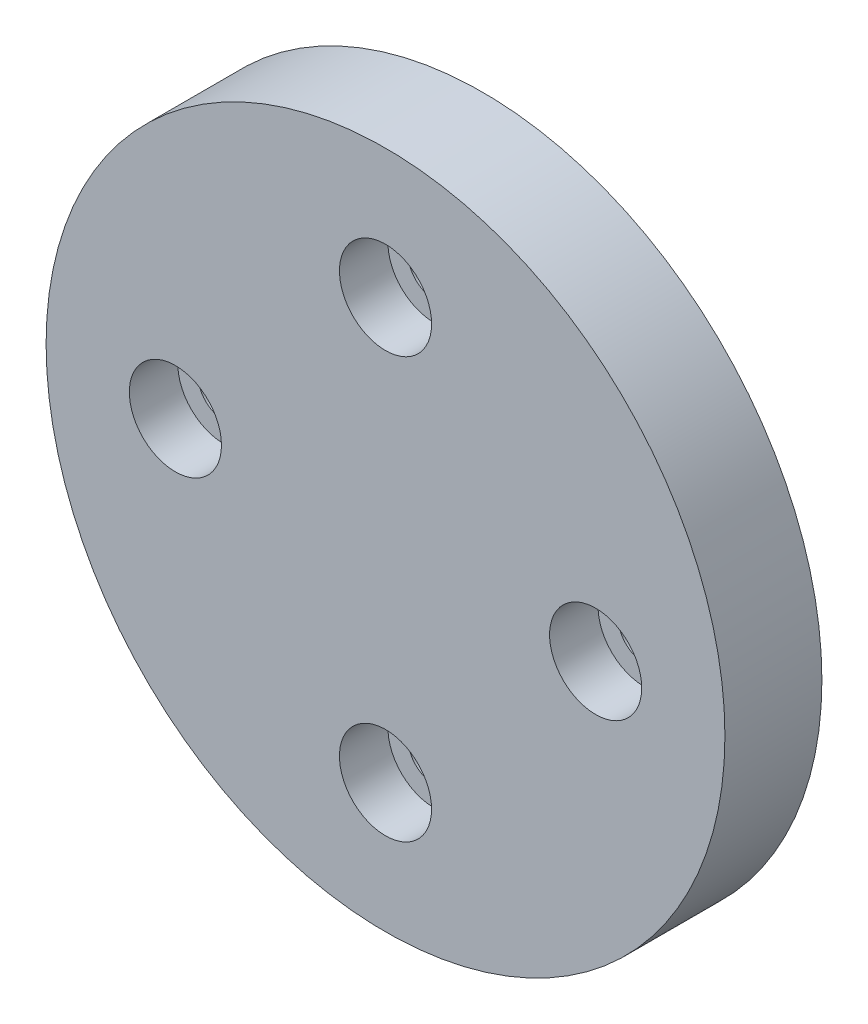
from build123d import *

# Parameters (mm, degrees)
SKETCH1_R           = 21
SKETCH1_R_2         = 2.85
BOSS_EXTRUDE1_DEPTH = 6
SKETCH1_4_R         = 2.85
SKETCH1_4_R_2       = 1.6
BOSS_EXTRUDE2_DEPTH = 3


with BuildPart() as part:
    # Sketch1 → Boss-Extrude1 (new body)
    with BuildSketch(Plane(origin=(0, 0, 0), x_dir=(0, 1, 0), z_dir=(0, 0, 1))):
        Circle(SKETCH1_R)
        with Locations((0, -13)):
            Circle(SKETCH1_R_2, mode=Mode.SUBTRACT)
        with Locations((13, 0)):
            Circle(SKETCH1_R_2, mode=Mode.SUBTRACT)
        with Locations((-13, 0)):
            Circle(SKETCH1_R_2, mode=Mode.SUBTRACT)
        with Locations((0, 13)):
            Circle(SKETCH1_R_2, mode=Mode.SUBTRACT)
    extrude(amount=BOSS_EXTRUDE1_DEPTH)

    # Sketch1<4> → Boss-Extrude2 (add)
    # profile 1 of 4: a face of its own
    with BuildSketch(Plane(origin=(0, 0, 0), x_dir=(0, 1, 0), z_dir=(0, 0, 1))):
        with Locations((0, 13)):
            Circle(SKETCH1_4_R)
        with Locations((0, 13)):
            Circle(SKETCH1_4_R_2, mode=Mode.SUBTRACT)
    # profile 2 of 4: a face of its own
    with BuildSketch(Plane(origin=(0, 0, 0), x_dir=(0, 1, 0), z_dir=(0, 0, 1))):
        with Locations((13, 0)):
            Circle(SKETCH1_4_R)
        with Locations((13, 0)):
            Circle(SKETCH1_4_R_2, mode=Mode.SUBTRACT)
    # profile 3 of 4: a face of its own
    with BuildSketch(Plane(origin=(0, 0, 0), x_dir=(0, 1, 0), z_dir=(0, 0, 1))):
        with Locations((0, -13)):
            Circle(SKETCH1_4_R)
        with Locations((0, -13)):
            Circle(SKETCH1_4_R_2, mode=Mode.SUBTRACT)
    # profile 4 of 4: a face of its own
    with BuildSketch(Plane(origin=(0, 0, 0), x_dir=(0, 1, 0), z_dir=(0, 0, 1))):
        with Locations((-13, 0)):
            Circle(SKETCH1_4_R)
        with Locations((-13, 0)):
            Circle(SKETCH1_4_R_2, mode=Mode.SUBTRACT)
    extrude(amount=BOSS_EXTRUDE2_DEPTH)


solid = part.part
